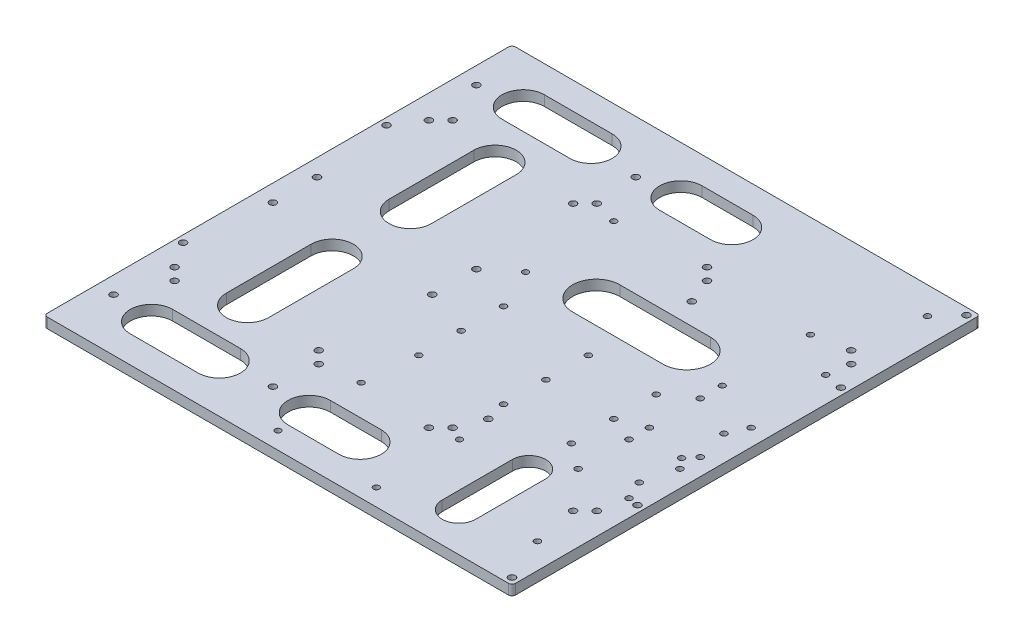
from build123d import *

# Parameters (mm, degrees)
SKETCH_1_W                = 276
SKETCH_1_H                = 276
EXTRUDE_1_DEPTH           = 6
FILLET_1_R                = 2
SKETCH_2_R                = 2
CUT_EXTRUDE_1_DEPTH       = 6
SKETCH_3_R                = 2
CUT_EXTRUDE_150_164_DEPTH = 6
SKETCH_4_R                = 2
CUT_EXTRUDE_94_94_DEPTH   = 6
SKETCH_7_R                = 1.75
JETSON_DEPTH              = 6
SKETCH_8_R                = 1.75
CUT_EXTRUDE_7_DEPTH       = 6
SKETCH_9_R                = 1.8
CUT_EXTRUDE_8_DEPTH       = 6
CUT_EXTRUDE_5_DEPTH       = 6


with BuildPart() as part:
    # Эскиз1 → Бобышка-Вытянуть1 (new body)
    with BuildSketch(Plane(origin=(0, 0, 0), x_dir=(1, 0, 0), z_dir=(0, 1, 0))):
        Rectangle(SKETCH_1_W, SKETCH_1_H)
    extrude(amount=EXTRUDE_1_DEPTH)

    # Скругление1
    fillet_1_edges = [part.edges().sort_by_distance(p)[0] for p in [
        (138, 3, 138),
        (-138, 3, 138),
        (-138, 3, -138),
        (138, 3, -138),
    ]]
    fillet(fillet_1_edges, radius=FILLET_1_R)

    # Эскиз2 → Вырез-Вытянуть1 (cut)
    with BuildSketch(Plane(origin=(0, 6, 0), x_dir=(1, 0, 0), z_dir=(0, 1, 0))):
        with Locations(Location((-134, 60, 0), (0, 0, 270))):
            Circle(SKETCH_2_R)
        with Locations(Location((134, 60, 0), (0, 0, 90))):
            Circle(SKETCH_2_R)
        with Locations(Location((134, -60, 0), (0, 0, 270))):
            Circle(SKETCH_2_R)
        with Locations(Location((-134, -60, 0), (0, 0, 90))):
            Circle(SKETCH_2_R)
        with Locations(Location((46, 60, 0), (0, 0, 270))):
            Circle(SKETCH_2_R)
        with Locations(Location((46, -60, 0), (0, 0, 90))):
            Circle(SKETCH_2_R)
        with Locations(Location((134, 134, 0), (0, 0, 270))):
            Circle(SKETCH_2_R)
        with Locations(Location((134, -134, 0), (0, 0, 90))):
            Circle(SKETCH_2_R)
    extrude(amount=-CUT_EXTRUDE_1_DEPTH, mode=Mode.SUBTRACT)

    # Эскиз3 → 150х164 (cut)
    with BuildSketch(Plane(origin=(0, 6, 0), x_dir=(1, 0, 0), z_dir=(0, 1, 0))):
        with Locations(Location((-32, 82, 0), (0, 0, 270))):
            Circle(SKETCH_3_R)
        with Locations(Location((118, 82, 0), (0, 0, 270))):
            Circle(SKETCH_3_R)
        with Locations(Location((125, 75, 0), (0, 0, 270))):
            Circle(SKETCH_3_R)
        with Locations(Location((-39, 75, 0), (0, 0, 270))):
            Circle(SKETCH_3_R)
        with Locations(Location((118, -82, 0), (0, 0, 90))):
            Circle(SKETCH_3_R)
        with Locations(Location((125, -75, 0), (0, 0, 90))):
            Circle(SKETCH_3_R)
        with Locations(Location((-32, -82, 0), (0, 0, 90))):
            Circle(SKETCH_3_R)
        with Locations(Location((-39, -75, 0), (0, 0, 90))):
            Circle(SKETCH_3_R)
        with Locations(Location((-124, 75, 0), (0, 0, 270))):
            Circle(SKETCH_3_R)
        with Locations(Location((40, 75, 0), (0, 0, 270))):
            Circle(SKETCH_3_R)
        with Locations(Location((33, 82, 0), (0, 0, 270))):
            Circle(SKETCH_3_R)
        with Locations(Location((40, -75, 0), (0, 0, 270))):
            Circle(SKETCH_3_R)
        with Locations(Location((33, -82, 0), (0, 0, 270))):
            Circle(SKETCH_3_R)
        with Locations(Location((-117, -82, 0), (0, 0, 270))):
            Circle(SKETCH_3_R)
        with Locations(Location((-124, -75, 0), (0, 0, 270))):
            Circle(SKETCH_3_R)
        with Locations(Location((-117, 82, 0), (0, 0, 90))):
            Circle(SKETCH_3_R)
    extrude(amount=-CUT_EXTRUDE_150_164_DEPTH, mode=Mode.SUBTRACT)

    # Эскиз4 → 94х94 (cut)
    with BuildSketch(Plane(origin=(0, 6, 0), x_dir=(1, 0, 0), z_dir=(0, 1, 0))):
        with Locations(Location((-128, 107, 0), (0, 0, 270))):
            Circle(SKETCH_4_R)
        with Locations(Location((-34, 107, 0), (0, 0, 270))):
            Circle(SKETCH_4_R)
        with Locations(Location((-34, 13, 0), (0, 0, 90))):
            Circle(SKETCH_4_R)
        with Locations(Location((-128, 13, 0), (0, 0, 90))):
            Circle(SKETCH_4_R)
        with Locations(Location((-128, -13, 0), (0, 0, 270))):
            Circle(SKETCH_4_R)
        with Locations(Location((-34, -13, 0), (0, 0, 270))):
            Circle(SKETCH_4_R)
        with Locations(Location((-34, -107, 0), (0, 0, 90))):
            Circle(SKETCH_4_R)
        with Locations(Location((-128, -107, 0), (0, 0, 90))):
            Circle(SKETCH_4_R)
    extrude(amount=-CUT_EXTRUDE_94_94_DEPTH, mode=Mode.SUBTRACT)

    # Эскиз7 → Jetson (cut)
    with BuildSketch(Plane(origin=(0, 6, 0), x_dir=(1, 0, 0), z_dir=(0, 1, 0))):
        with Locations(Location((-18, 78, 0), (0, 0, 270))):
            Circle(SKETCH_7_R)
        with Locations(Location((-18, 26, 0), (0, 0, 270))):
            Circle(SKETCH_7_R)
        with Locations(Location((98, 78, 0), (0, 0, 270))):
            Circle(SKETCH_7_R)
        with Locations(Location((98, 26, 0), (0, 0, 270))):
            Circle(SKETCH_7_R)
    extrude(amount=-JETSON_DEPTH, mode=Mode.SUBTRACT)

    # Эскиз8 → Вырез-Вытянуть7 (cut)
    with BuildSketch(Plane(origin=(0, 6, 0), x_dir=(1, 0, 0), z_dir=(0, 1, 0))):
        with Locations(Location((48, -79, 0), (0, 0, 270))):
            Circle(SKETCH_8_R)
        with Locations(Location((-10, -79, 0), (0, 0, 270))):
            Circle(SKETCH_8_R)
        with Locations(Location((-10, -128, 0), (0, 0, 270))):
            Circle(SKETCH_8_R)
        with Locations(Location((48, -128, 0), (0, 0, 270))):
            Circle(SKETCH_8_R)
    extrude(amount=-CUT_EXTRUDE_7_DEPTH, mode=Mode.SUBTRACT)

    # Эскиз9 → Вырез-Вытянуть8 (cut)
    with BuildSketch(Plane(origin=(0, 6, 0), x_dir=(1, 0, 0), z_dir=(0, 1, 0))):
        with Locations(Location((-7, 2, 0), (0, 0, 270))):
            Circle(SKETCH_9_R)
        with Locations(Location((43, 2, 0), (0, 0, 270))):
            Circle(SKETCH_9_R)
        with Locations(Location((83, 2, 0), (0, 0, 270))):
            Circle(SKETCH_9_R)
        with Locations(Location((123, 2, 0), (0, 0, 270))):
            Circle(SKETCH_9_R)
        with Locations(Location((123, -48, 0), (0, 0, 90))):
            Circle(SKETCH_9_R)
        with Locations(Location((83, -48, 0), (0, 0, 90))):
            Circle(SKETCH_9_R)
        with Locations(Location((43, -48, 0), (0, 0, 90))):
            Circle(SKETCH_9_R)
        with Locations(Location((-7, -48, 0), (0, 0, 90))):
            Circle(SKETCH_9_R)
        with Locations(Location((43, -23, 0), (0, 0, 270))):
            Circle(SKETCH_9_R)
        with Locations(Location((-7, -23, 0), (0, 0, 270))):
            Circle(SKETCH_9_R)
        with Locations(Location((83, -23, 0), (0, 0, 270))):
            Circle(SKETCH_9_R)
        with Locations(Location((123, -23, 0), (0, 0, 270))):
            Circle(SKETCH_9_R)
        with Locations(Location((123, 62, 0), (0, 0, 270))):
            Circle(SKETCH_9_R)
        with Locations(Location((123, 122, 0), (0, 0, 270))):
            Circle(SKETCH_9_R)
        with Locations(Location((123, -108, 0), (0, 0, 90))):
            Circle(SKETCH_9_R)
        with Locations(Location((98, 13, 0), (0, 0, 270))):
            Circle(SKETCH_9_R)
        with Locations(Location((128, 13, 0), (0, 0, 270))):
            Circle(SKETCH_9_R)
        with Locations(Location((98, -17, 0), (0, 0, 270))):
            Circle(SKETCH_9_R)
        with Locations(Location((128, -17, 0), (0, 0, 270))):
            Circle(SKETCH_9_R)
        with Locations(Location((98, -29, 0), (0, 0, 90))):
            Circle(SKETCH_9_R)
        with Locations(Location((128, -29, 0), (0, 0, 90))):
            Circle(SKETCH_9_R)
        with Locations(Location((128, -59, 0), (0, 0, 90))):
            Circle(SKETCH_9_R)
        with Locations(Location((98, -59, 0), (0, 0, 90))):
            Circle(SKETCH_9_R)
    extrude(amount=-CUT_EXTRUDE_8_DEPTH, mode=Mode.SUBTRACT)

    # Эскиз6 → Вырез-Вытянуть5 (cut)
    with BuildSketch(Plane(origin=(0, 6, 0), x_dir=(1, 0, 0), z_dir=(0, 1, 0))):
        with BuildLine():
            Line((-103, 97.107947115), (-63, 97.107947115))
            ThreePointArc((-63, 97.107947115), (-50.5, 109.607947115), (-63, 122.107947115))
            Line((-63, 122.107947115), (-103, 122.107947115))
            ThreePointArc((-103, 122.107947115), (-115.5, 109.607947115), (-103, 97.107947115))
        make_face()
        with BuildLine():
            ThreePointArc((-70.5, 23), (-83, 10.5), (-95.5, 23))
            Line((-95.5, 23), (-95.5, 73))
            ThreePointArc((-95.5, 73), (-83, 85.5), (-70.5, 73))
            Line((-70.5, 73), (-70.5, 23))
        make_face()
        with BuildLine():
            Line((-70.5, -73), (-70.5, -23))
            ThreePointArc((-70.5, -23), (-83, -10.5), (-95.5, -23))
            Line((-95.5, -23), (-95.5, -73))
            ThreePointArc((-95.5, -73), (-83, -85.5), (-70.5, -73))
        make_face()
        with BuildLine():
            ThreePointArc((-63, -97.107947115), (-50.5, -109.607947115), (-63, -122.107947115))
            Line((-63, -122.107947115), (-103, -122.107947115))
            ThreePointArc((-103, -122.107947115), (-115.5, -109.607947115), (-103, -97.107947115))
            Line((-103, -97.107947115), (-63, -97.107947115))
        make_face()
        with BuildLine():
            Line((16.282052685, 19.480778886), (69.672016653, 19.480778886))
            ThreePointArc((69.672016653, 19.480778886), (83.580326595, 33.389088828), (69.672016653, 47.297398769))
            Line((69.672016653, 47.297398769), (16.282052685, 47.297398769))
            ThreePointArc((16.282052685, 47.297398769), (2.373742744, 33.389088828), (16.282052685, 19.480778886))
        make_face()
        with BuildLine():
            Line((73.817325583, -73.648631168), (73.817325583, -114.962929045))
            ThreePointArc((73.817325583, -114.962929045), (83.686480688, -124.832084149), (93.555635792, -114.962929045))
            Line((93.555635792, -114.962929045), (93.555635792, -73.648631168))
            ThreePointArc((93.555635792, -73.648631168), (83.686480688, -63.779476064), (73.817325583, -73.648631168))
        make_face()
        with BuildLine():
            ThreePointArc((20, -97.107947115), (32.5, -109.607947115), (20, -122.107947115))
            Line((20, -122.107947115), (-10, -122.107947115))
            ThreePointArc((-10, -122.107947115), (-22.5, -109.607947115), (-10, -97.107947115))
            Line((-10, -97.107947115), (20, -97.107947115))
        make_face()
        with BuildLine():
            Line((-10, 97.107947115), (20, 97.107947115))
            ThreePointArc((20, 97.107947115), (32.5, 109.607947115), (20, 122.107947115))
            Line((20, 122.107947115), (-10, 122.107947115))
            ThreePointArc((-10, 122.107947115), (-22.5, 109.607947115), (-10, 97.107947115))
        make_face()
    extrude(amount=-CUT_EXTRUDE_5_DEPTH, mode=Mode.SUBTRACT)


solid = part.part
